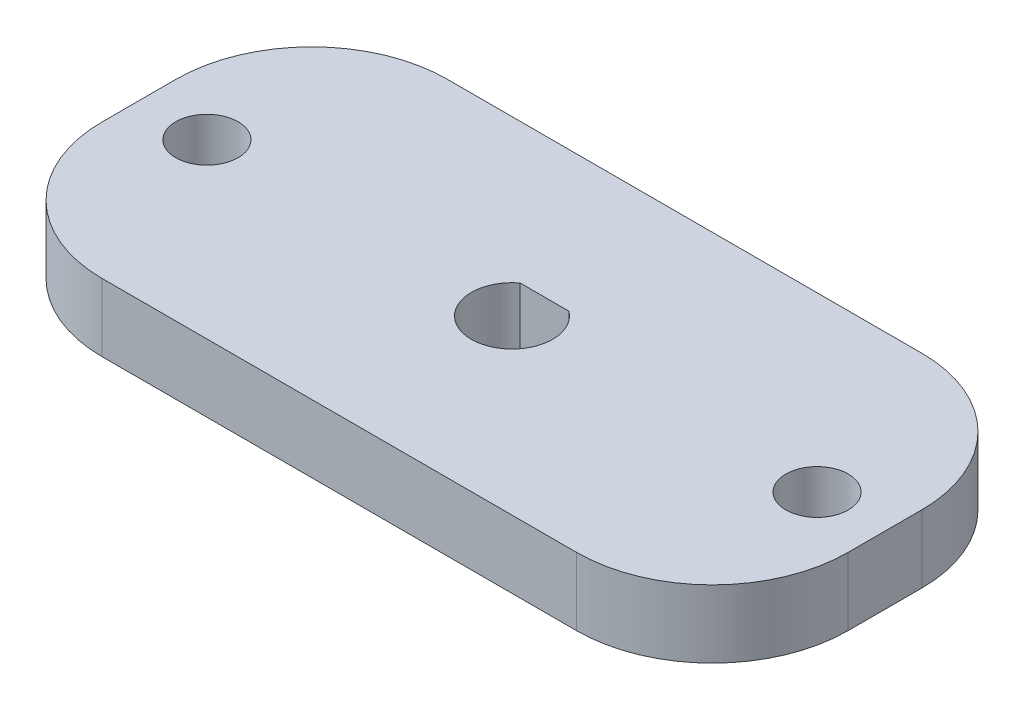
from build123d import *

# Parameters (mm, degrees)
SZKIC1_R                    = 2.3
DODANIE_WYCI_GNI_CIE1_DEPTH = 5


with BuildPart() as part:
    # Szkic1 → Dodanie-wyciągnięcie1 (new body)
    with BuildSketch(Plane(origin=(0, 0, 0), x_dir=(1, 0, 0), z_dir=(0, 1, 0))):
        with BuildLine():
            Line((-17.5, -12.72606383), (17.5, -12.72606383))
            ThreePointArc((17.5, -12.72606383), (24.571067812, -9.797131642), (27.5, -2.72606383))
            Line((27.5, -2.72606383), (27.5, 2.72606383))
            ThreePointArc((27.5, 2.72606383), (24.571067812, 9.797131642), (17.5, 12.72606383))
            Line((17.5, 12.72606383), (-17.5, 12.72606383))
            ThreePointArc((-17.5, 12.72606383), (-24.571067812, 9.797131642), (-27.5, 2.72606383))
            Line((-27.5, 2.72606383), (-27.5, -2.72606383))
            ThreePointArc((-27.5, -2.72606383), (-24.571067812, -9.797131642), (-17.5, -12.72606383))
        make_face()
        with Locations(Location((-22.5, 0, 0), (0, 0, 270))):
            Circle(SZKIC1_R, mode=Mode.SUBTRACT)
        with Locations(Location((22.5, 0, 0), (0, 0, 90))):
            Circle(SZKIC1_R, mode=Mode.SUBTRACT)
        with BuildLine():
            Line((-1.8, 2.4), (1.8, 2.4))
            ThreePointArc((1.8, 2.4), (0, -3), (-1.8, 2.4))
        make_face(mode=Mode.SUBTRACT)
    extrude(amount=DODANIE_WYCI_GNI_CIE1_DEPTH)


solid = part.part
